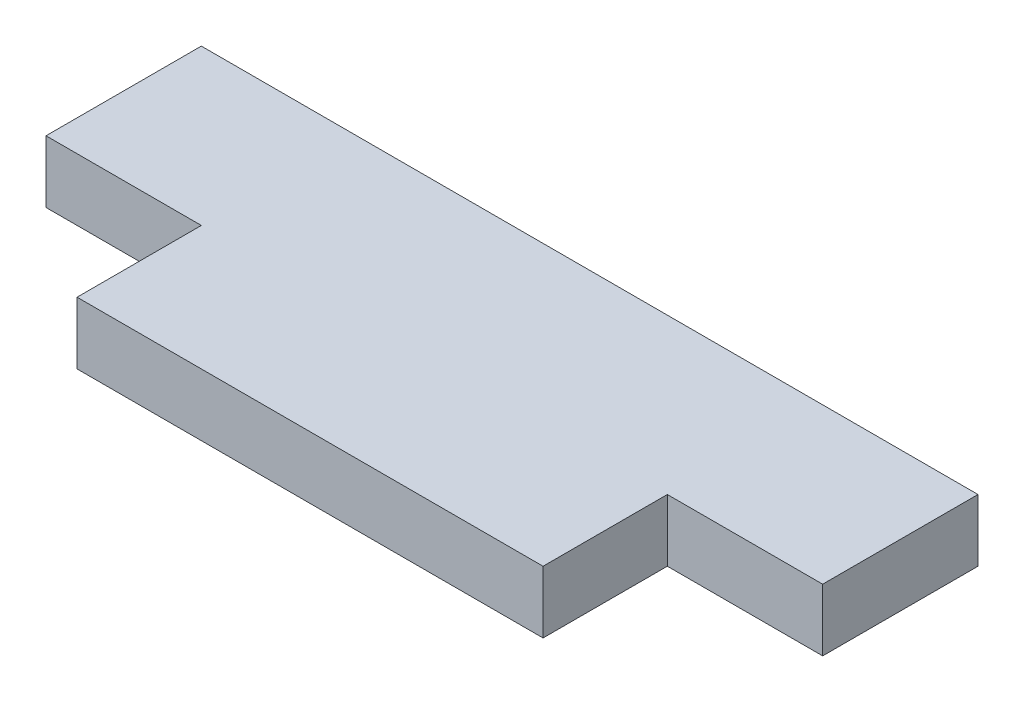
from build123d import *

# Parameters (mm, degrees)
SKETCH1_W           = 15
SKETCH1_H           = 2
BOSS_EXTRUDE1_DEPTH = 4
SKETCH2_W           = 25
SKETCH2_H           = 2
BOSS_EXTRUDE2_DEPTH = 5


with BuildPart() as part:
    # Sketch1 → Boss-Extrude1 (new body)
    with BuildSketch(Plane.XY):
        Rectangle(SKETCH1_W, SKETCH1_H)
    extrude(amount=BOSS_EXTRUDE1_DEPTH)

    # Sketch2 → Boss-Extrude2 (add)
    with BuildSketch(Plane(origin=(0, 0, 0), x_dir=(-1, 0, 0), z_dir=(0, 0, -1))):
        Rectangle(SKETCH2_W, SKETCH2_H)
    extrude(amount=BOSS_EXTRUDE2_DEPTH)


solid = part.part
